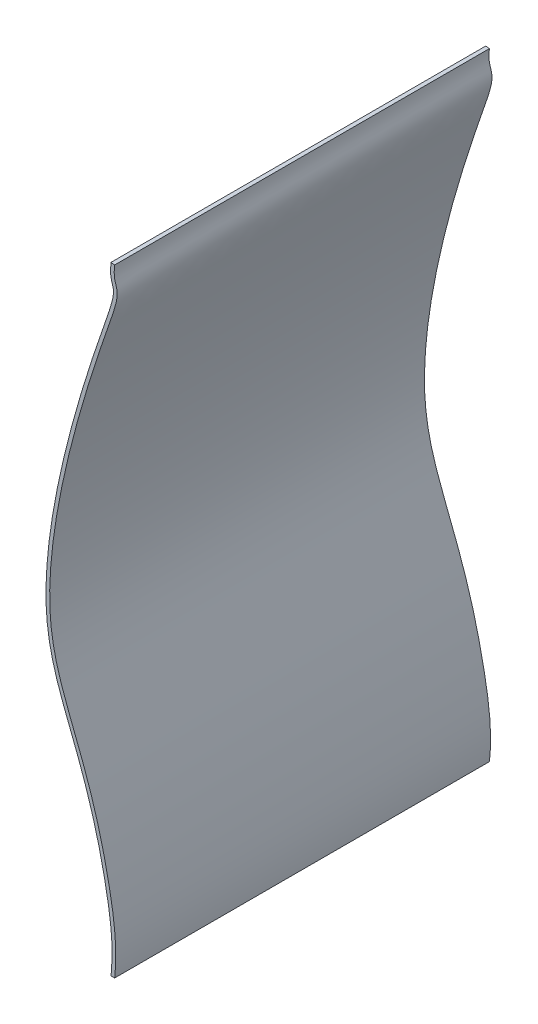
from build123d import *

# Parameters (mm, degrees)
BOSS_EXTRUDE3_DEPTH = 30.5


with BuildPart() as part:
    # Sketch3 → Boss-Extrude3 (new body)
    with BuildSketch(Plane.XY):
        with BuildLine():
            Line((0, 50.283595597), (0.298112958, 50.25))
            add(Edge.make_bspline(
                [(0.298112958, 50.25), (0.28478564, 50.131739077), (0.263569389, 49.875050281), (0.2622349, 49.514746788), (0.305293973, 49.204227285), (0.388742231, 48.948051747), (0.490993147, 48.630732209), (0.521331375, 48.199383254), (0.392904156, 47.428120216), (-0.134382542, 45.856563222), (-0.903538746, 43.673857833), (-1.594799818, 41.552760651), (-2.24383293, 39.435372394), (-3.031889636, 36.656927859), (-3.866288222, 33.28486732), (-4.584941957, 29.495615446), (-4.982713785, 26.054247031), (-5.020737192, 23.060525629), (-4.667982161, 20.596881047), (-4.016306461, 18.375517879), (-3.148165357, 16.133886804), (-2.154516002, 13.618046014), (-1.304375909, 11.087955106), (-0.658655191, 8.67792644), (-0.206656294, 6.651099048), (0.214255911, 4.353581481), (0.393279926, 2.519829169), (0.393122336, 1.325859871), (0.36028816, 0.609419432), (0.325044689, 0.208686666), (0.30652647, 0.038652555), (0.302865336, 0.007692257), (0.302004613, 0)],
                knots=[0, 0, 0, 0, 0.007811725, 0.015623451, 0.031246902, 0.046870353, 0.062493804, 0.078117255, 0.093740706, 0.124987608, 0.156234509, 0.187481411, 0.218728313, 0.249975215, 0.312469019, 0.374962823, 0.437456626, 0.49995043, 0.562444234, 0.624938038, 0.687431841, 0.749925645, 0.812419449, 0.843666351, 0.874913253, 0.906160155, 0.937407057, 0.953030507, 0.968653958, 0.984277409, 0.992089135, 0.995272562, 0.995272562, 0.995272562, 0.995272562], degree=3))
            Line((0.302004613, 0), (0, 0))
            add(Edge.make_bspline(
                [(0, 50.283595597), (-0.183734666, 48.653212787), (0.734674188, 49.149312845), (-3.401297055, 37.749700344), (-7.544735759, 19.866885032), (-1.837255242, 14.811171974), (0.272675027, 2.113664464), (0.007414605, 0.070039471), (0, 0)],
                knots=[0, 0, 0, 0, 0.092046794, 0.14187884, 0.498320457, 0.87739074, 0.927558695, 1, 1, 1, 1], degree=3))
        make_face()
    extrude(amount=BOSS_EXTRUDE3_DEPTH)


solid = part.part
